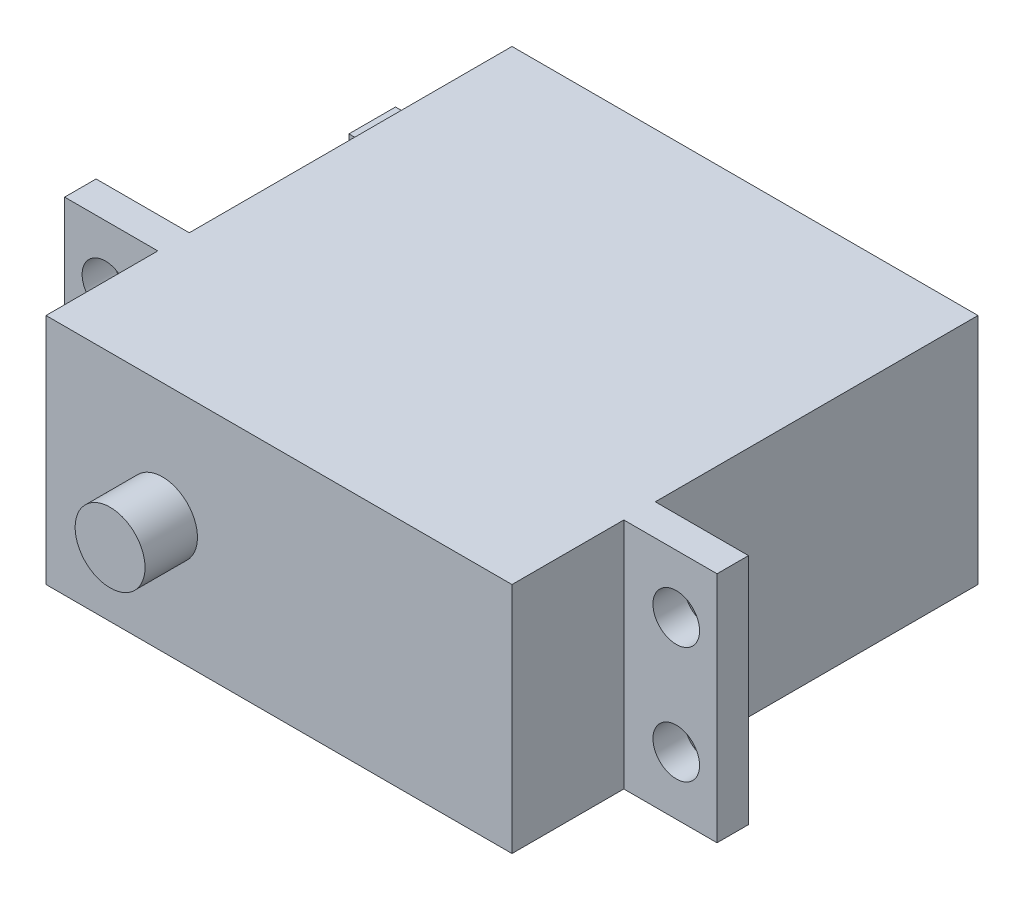
from build123d import *

# Parameters (mm, degrees)
SKETCH_1_W      = 40
SKETCH_1_H      = 40
EXTRUDE_1_DEPTH = 20
SKETCH_2_R      = 3
EXTRUDE_2_DEPTH = 4.5
SKETCH_4_R      = 2
SKETCH_4_W      = 8
SKETCH_4_H      = 20
EXTRUDE_4_DEPTH = 2.7
SKETCH_5_W      = 4
SKETCH_5_H      = 7
EXTRUDE_5_DEPTH = 7


with BuildPart() as part:
    # 草图1 → 凸台-拉伸1 (new body)
    with BuildSketch(Plane(origin=(0, 0, 0), x_dir=(1, 0, 0), z_dir=(0, 1, 0))):
        with Locations((20, 20)):
            Rectangle(SKETCH_1_W, SKETCH_1_H)
    extrude(amount=EXTRUDE_1_DEPTH)

    # 草图2 → 凸台-拉伸2 (add)
    with BuildSketch(Plane.XY):
        with Locations(Location((10, 10, 0), (0, 0, 180))):
            Circle(SKETCH_2_R)
    extrude(amount=EXTRUDE_2_DEPTH)

    # 草图4 → 凸台-拉伸4 (add)
    # profile 1 of 3: a face of its own
    with BuildSketch(Plane(origin=(0, 0, -12.3), x_dir=(-1, 0, 0), z_dir=(0, 0, -1))):
        with BuildLine():
            Line((-44.5, 17), (-44.5, 20))
            Line((-44.5, 20), (-48, 20))
            Line((-48, 20), (-48, 0))
            Line((-48, 0), (-40, 0))
            Line((-40, 0), (-40, 15))
            Line((-40, 15), (-42.5, 15))
            ThreePointArc((-42.5, 15), (-45.914213562, 13.585786438), (-44.5, 17))
        make_face()
        with Locations((-44.5, 5)):
            Circle(SKETCH_4_R, mode=Mode.SUBTRACT)
    # profile 2 of 3: a face of its own
    with BuildSketch(Plane(origin=(0, 0, -12.3), x_dir=(-1, 0, 0), z_dir=(0, 0, -1))):
        with BuildLine():
            Line((-40, 15), (-40, 20))
            Line((-40, 20), (-44.5, 20))
            Line((-44.5, 20), (-44.5, 17))
            ThreePointArc((-44.5, 17), (-43.085786438, 16.414213562), (-42.5, 15))
            Line((-42.5, 15), (-40, 15))
        make_face()
    # profile 3 of 3: a face of its own
    with BuildSketch(Plane(origin=(0, 0, -12.3), x_dir=(-1, 0, 0), z_dir=(0, 0, -1))):
        with Locations((4, 10)):
            Rectangle(SKETCH_4_W, SKETCH_4_H)
        with Locations((4.5, 5)):
            Circle(SKETCH_4_R, mode=Mode.SUBTRACT)
        with Locations((4.5, 15)):
            Circle(SKETCH_4_R, mode=Mode.SUBTRACT)
    extrude(amount=-EXTRUDE_4_DEPTH)

    # 草图5 → 凸台-拉伸5 (add)
    with BuildSketch(Plane.ZY):
        with Locations((-35, 10)):
            Rectangle(SKETCH_5_W, SKETCH_5_H)
    extrude(amount=EXTRUDE_5_DEPTH)


solid = part.part
